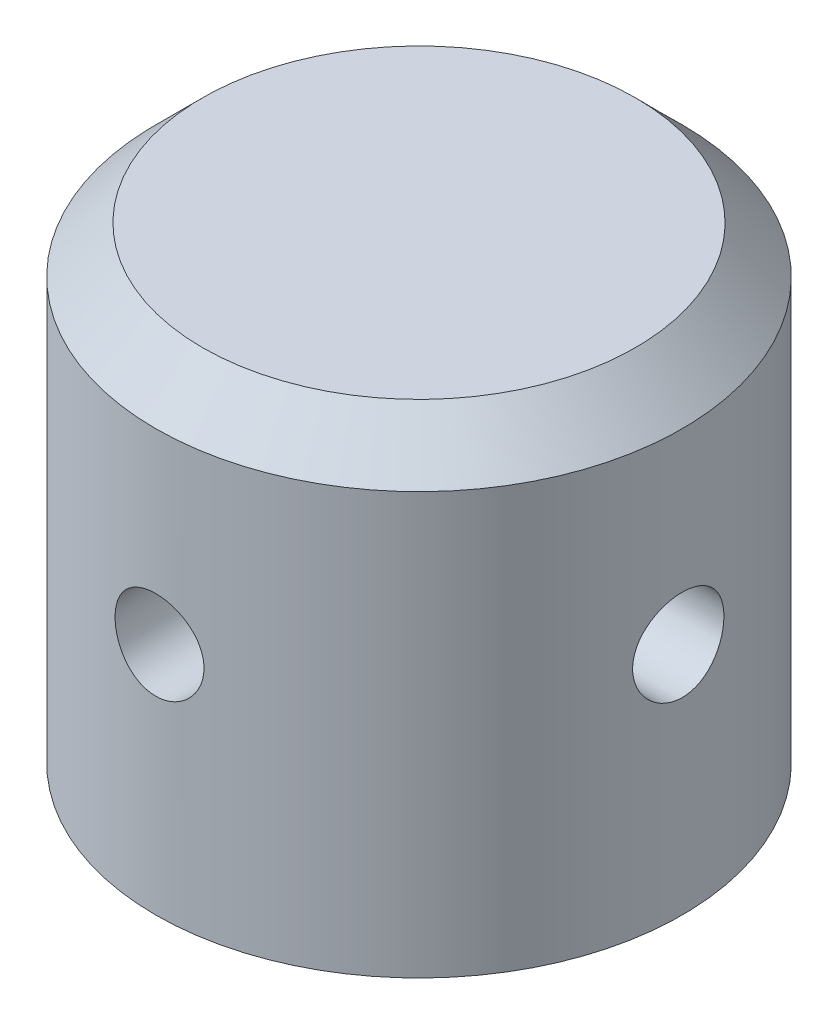
from build123d import *

# Parameters (mm, degrees)
SKETCH1_R               = 14.2875
BOSS_EXTRUDE1_DEPTH     = 25.4
SKETCH2_R               = 3.302
CUT_EXTRUDE1_DEPTH      = 8
CUT_EXTRUDE2_DEPTH      = 33.456514177
CUT_EXTRUDE2_DEPTH_BACK = 33.456514177
SKETCH3_R               = 2.4765
CHAMFER1_SIZE           = 2.54
CUT_EXTRUDE3_DEPTH      = 33.456514265
CUT_EXTRUDE3_DEPTH_BACK = 33.456514265
SKETCH4_R               = 2.413


with BuildPart() as part:
    # Sketch1 → Boss-Extrude1 (new body)
    with BuildSketch(Plane(origin=(0, 0, 0), x_dir=(1, 0, 0), z_dir=(0, 1, 0))):
        with Locations(Location((0, 0, 0), (0, 0, 270))):
            Circle(SKETCH1_R)
    extrude(amount=BOSS_EXTRUDE1_DEPTH)

    # Sketch2 → Cut-Extrude1 (cut)
    with BuildSketch(Plane(origin=(0, 0, 0), x_dir=(-1, 0, 0), z_dir=(0, -1, 0))):
        with Locations(Location((0, 0, 0), (0, 0, 90))):
            Circle(SKETCH2_R)
    extrude(amount=-CUT_EXTRUDE1_DEPTH, mode=Mode.SUBTRACT)

    # Sketch3 → Cut-Extrude2 (cut, two sides: drawn at the far end of the back side and taken through both)
    with BuildSketch(Plane(origin=(0, 0, 0), x_dir=(0, 0, -1), z_dir=(1, 0, 0)).offset(-CUT_EXTRUDE2_DEPTH_BACK)):
        with Locations((0, 12.7)):
            Circle(SKETCH3_R)
    extrude(amount=CUT_EXTRUDE2_DEPTH + CUT_EXTRUDE2_DEPTH_BACK, mode=Mode.SUBTRACT)

    # Chamfer1
    chamfer1_edges = [part.edges().sort_by_distance(p)[0] for p in [
        (0, 25.4, -14.2875),
    ]]
    chamfer(chamfer1_edges, length=CHAMFER1_SIZE)

    # Sketch4 → Cut-Extrude3 (cut, two sides: drawn at the far end of the back side and taken through both)
    with BuildSketch(Plane.XY.offset(-CUT_EXTRUDE3_DEPTH_BACK)):
        with Locations((0, 12.7)):
            Circle(SKETCH4_R)
    extrude(amount=CUT_EXTRUDE3_DEPTH + CUT_EXTRUDE3_DEPTH_BACK, mode=Mode.SUBTRACT)


solid = part.part
